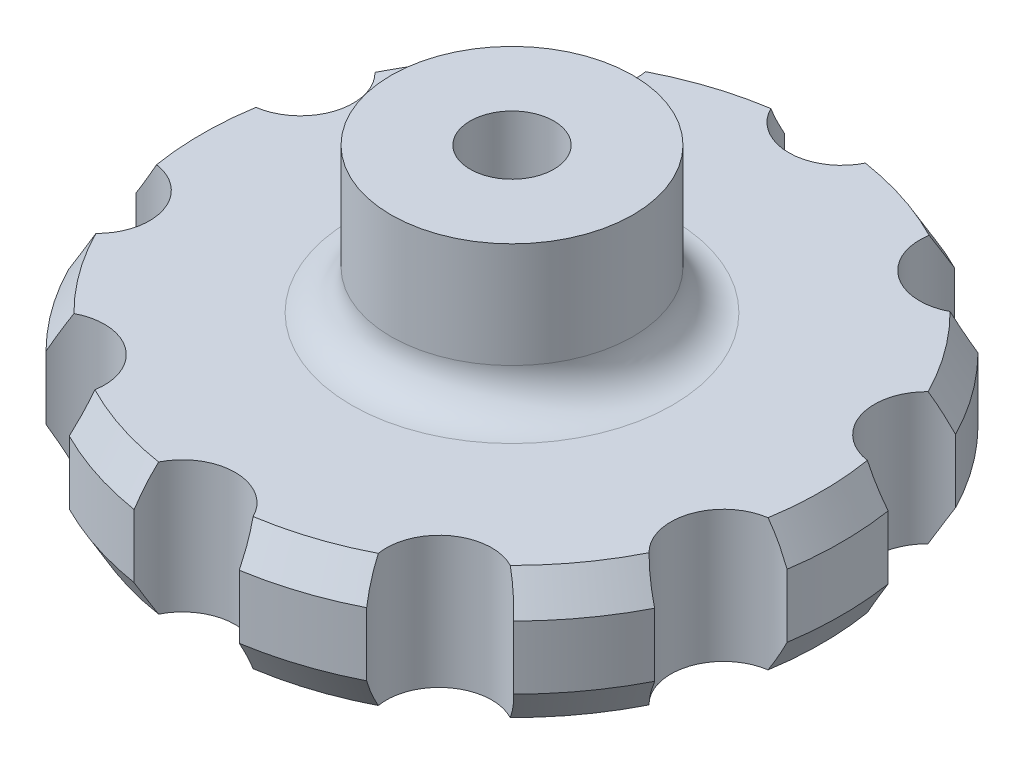
from build123d import *
from OCP.BRepFilletAPI import BRepFilletAPI_MakeChamfer

# Parameters (mm, degrees)
CUT_EXTRUDE3_DEPTH = 38.027017163
CHAMFER1_SIZE      = 1.5
CHAMFER1_SIZE2     = 2.598076211
CIRPATTERN1_COUNT  = 10
CUT_EXTRUDE2_DEPTH = 5


with BuildPart() as part:
    # Sketch1 → Revolve1 (revolve)
    with BuildSketch(Plane.XY, mode=Mode.PRIVATE) as revolve1_sk:
        with BuildLine():
            Line((3.175, 0), (3.175, 21))
            Line((3.175, 21), (9.175, 21))
            Line((9.175, 21), (9.175, 13))
            ThreePointArc((9.175, 13), (10.053679656, 10.878679656), (12.175, 10))
            Line((12.175, 10), (25, 10))
            Line((25, 10), (25, 0))
            Line((25, 0), (3.175, 0))
        make_face()
    revolve(revolve1_sk.sketch.rotate(Axis((0, 0, 0), (0, 1, 0)), 90), axis=Axis((0, 0, 0), (0, 1, 0)))

    # Sketch4 → Cut-Extrude3 (cut, through all)
    with BuildSketch(Plane(origin=(0, 10, 0), x_dir=(1, 0, 0), z_dir=(0, 1, 0))):
        with BuildLine():
            ThreePointArc((-3.987179454, 24.68), (0, 21), (3.987179454, 24.68))
            ThreePointArc((3.987179454, 24.68), (0, 25), (-3.987179454, 24.68))
        make_face()
    cut_extrude3 = extrude(amount=-CUT_EXTRUDE3_DEPTH, mode=Mode.SUBTRACT)

    # Chamfer1: one chamfer whose edges measure the first distance from different faces: ONE call of the kernel's chamfer builder (chamfer() names one face for all edges)
    chamfer1_edges_1 = [part.edges().sort_by_distance(p)[0] for p in [
        (0, 10, 25),
    ]]
    chamfer1_side_1 = [part.faces().sort_by_distance(p)[0] for p in [
        (0, 10, 24.295152329),
    ]]
    chamfer1_edges_2 = [part.edges().sort_by_distance(p)[0] for p in [
        (0, 0, 25),
    ]]
    chamfer1_side_2 = [part.faces().sort_by_distance(p)[0] for p in [
        (0, 0, -20.295152329),
    ]]
    chamfer1 = BRepFilletAPI_MakeChamfer(part.part.solid().wrapped)
    for e in chamfer1_edges_1:
        chamfer1.Add(CHAMFER1_SIZE, CHAMFER1_SIZE2, e.wrapped, chamfer1_side_1[0].wrapped)  # the first distance lies on this face
    for e in chamfer1_edges_2:
        chamfer1.Add(CHAMFER1_SIZE, CHAMFER1_SIZE2, e.wrapped, chamfer1_side_2[0].wrapped)  # the first distance lies on this face
    add(Compound.cast(chamfer1.Shape()), mode=Mode.REPLACE)

    # CirPattern1: Cut-Extrude3 ×10 about axis
    cirpattern1_axis = Axis((0, 0, 0), (0, 1, 0))
    for i in range(1, CIRPATTERN1_COUNT):
        add(cut_extrude3.rotate(cirpattern1_axis, i * 360 / CIRPATTERN1_COUNT), mode=Mode.SUBTRACT)

    # Sketch3 → Cut-Extrude2 (cut)
    with BuildSketch(Plane.XZ):
        Polygon((3.207902433, 5.55625), (-3.207902433, 5.55625), (-6.415804866, 0), (-3.207902433, -5.55625), (3.207902433, -5.55625), (6.415804866, 0), align=None)
    extrude(amount=-CUT_EXTRUDE2_DEPTH, mode=Mode.SUBTRACT)


solid = part.part
